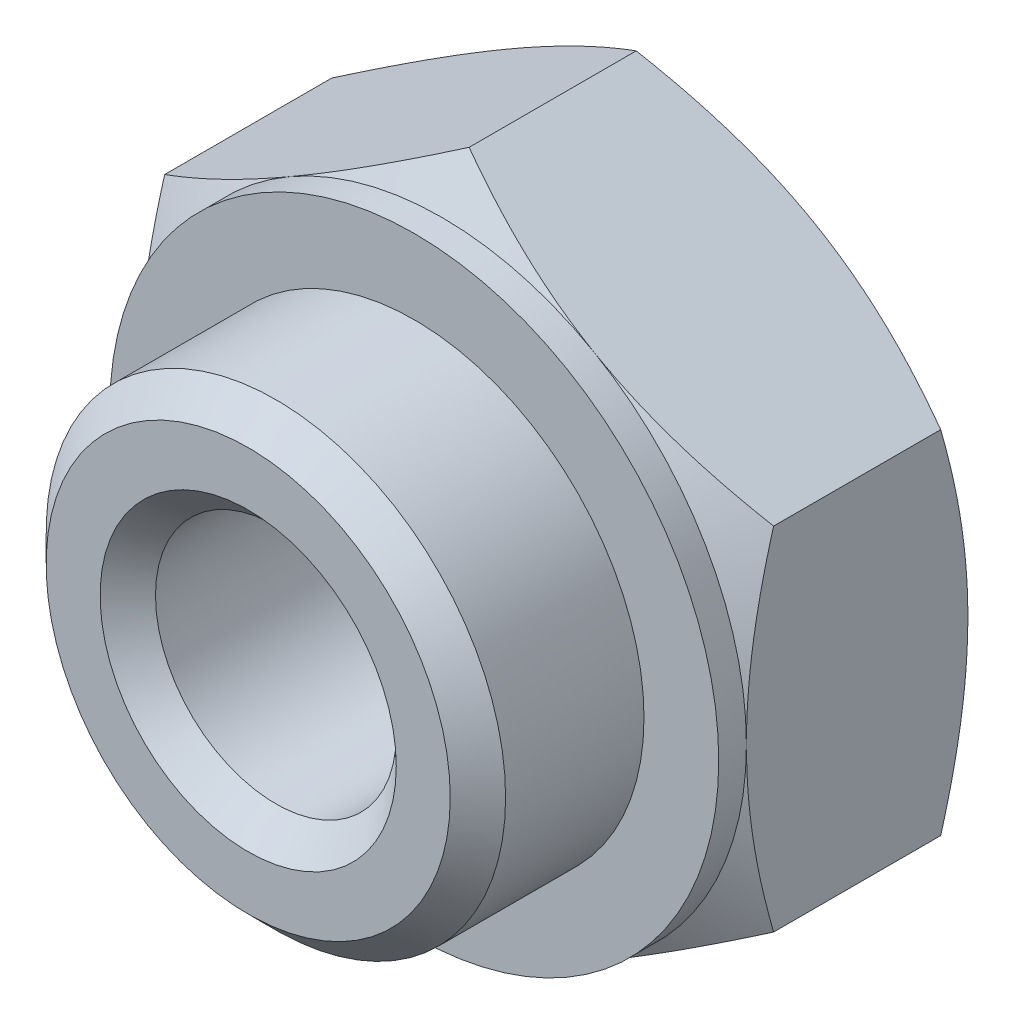
from build123d import *

# Parameters (mm, degrees)
SKETCH1_R                            = 4.35
BOSS_EXTRUDE1_DEPTH                  = 8
SKETCH2_R                            = 11
SKETCH2_R_2                          = 4.35
BOSS_EXTRUDE2_DEPTH                  = 1
SKETCH3_R                            = 8.3
SKETCH3_R_2                          = 4.35
BOSS_EXTRUDE3_DEPTH                  = 6
SZKIC9_OUTSIDE_W                     = 34.824
SZKIC9_OUTSIDE_H                     = 38.228
SZKIC9_OUTSIDE_R                     = 11
WYTNIJ_WYCI_GNI_CIE3_DEPTH           = 1
WYTNIJ_WYCI_GNI_CIE3_DRAFT           = -60
SZKIC10_OUTSIDE_W                    = 34.824
SZKIC10_OUTSIDE_H                    = 38.228
SZKIC10_OUTSIDE_R                    = 11
WYTNIJ_WYCI_GNI_CIE4_DEPTH           = 1
WYTNIJ_WYCI_GNI_CIE4_DRAFT           = -60
SZKIC11_R                            = 5.35
WYTNIJ_WYCI_GNI_CIE5_DEPTH           = 1
WYTNIJ_WYCI_GNI_CIE5_DRAFT           = -60
SZKIC13_OUTSIDE_W                    = 33.36
SZKIC13_OUTSIDE_H                    = 36.764
SZKIC13_OUTSIDE_R                    = 7.3
WYTNIJ_WYCI_GNI_CIE8_DEPTH           = 1
WYTNIJ_WYCI_GNI_CIE8_DRAFT           = -45
SZKIC13_OUTSIDE_R_2                  = 5.35
WYTNIJ_WYCI_GNI_CIE8_PROFILE_2_DEPTH = 1
WYTNIJ_WYCI_GNI_CIE8_PROFILE_2_DRAFT = -45


with BuildPart() as part:
    # Sketch1 → Boss-Extrude1 (new body)
    with BuildSketch(Plane.XY):
        Polygon((-11, 6.350852961), (-11, -6.350852961), (0, -12.701705922), (11, -6.350852961), (11, 6.350852961), (0, 12.701705922), align=None)
        Circle(SKETCH1_R, mode=Mode.SUBTRACT)
    extrude(amount=BOSS_EXTRUDE1_DEPTH)

    # Sketch2 → Boss-Extrude2 (add)
    with BuildSketch(Plane.XY.offset(8)):
        Circle(SKETCH2_R)
        Circle(SKETCH2_R_2, mode=Mode.SUBTRACT)
    extrude(amount=BOSS_EXTRUDE2_DEPTH)

    # Sketch3 → Boss-Extrude3 (add)
    with BuildSketch(Plane.XY.offset(9)):
        Circle(SKETCH3_R)
        Circle(SKETCH3_R_2, mode=Mode.SUBTRACT)
    extrude(amount=BOSS_EXTRUDE3_DEPTH)


with BuildPart() as wytnij_wyci_gni_cie3_tool:
    # Szkic9 outside → Wytnij-wyciągnięcie3 (with draft: the straight prism first)
    with BuildSketch(Plane(origin=(0, 0, 0), x_dir=(-1, 0, 0), z_dir=(0, 0, -1))):
        Rectangle(SZKIC9_OUTSIDE_W, SZKIC9_OUTSIDE_H)
        with Locations(Location((0, 0, 0), (0, 0, 180))):
            Circle(SZKIC9_OUTSIDE_R, mode=Mode.SUBTRACT)
    extrude(amount=-WYTNIJ_WYCI_GNI_CIE3_DEPTH)
    # Wytnij-wyciągnięcie3: the draft: its side faces are tilted about the plane it starts from
    wytnij_wyci_gni_cie3_sides = [wytnij_wyci_gni_cie3_tool.faces().sort_by_distance(p)[0] for p in [
        (0, -19.114, 0.5),
        (-17.412, 0, 0.5),
        (0, 19.114, 0.5),
        (17.412, 0, 0.5),
        (-11, 0, 0.5),
    ]]
    draft(wytnij_wyci_gni_cie3_sides, Plane(origin=(0, 0, 0), x_dir=(-1, 0, 0), z_dir=(0, 0, -1)), WYTNIJ_WYCI_GNI_CIE3_DRAFT)


with BuildPart() as part_1:
    add(part.part)

    # Wytnij-wyciągnięcie3: cut by wytnij_wyci_gni_cie3_tool
    add(wytnij_wyci_gni_cie3_tool.part, mode=Mode.SUBTRACT)


with BuildPart() as wytnij_wyci_gni_cie4_tool:
    # Szkic10 outside → Wytnij-wyciągnięcie4 (with draft: the straight prism first)
    with BuildSketch(Plane.XY.offset(8)):
        Rectangle(SZKIC10_OUTSIDE_W, SZKIC10_OUTSIDE_H)
        Circle(SZKIC10_OUTSIDE_R, mode=Mode.SUBTRACT)
    extrude(amount=-WYTNIJ_WYCI_GNI_CIE4_DEPTH)
    # Wytnij-wyciągnięcie4: the draft: its side faces are tilted about the plane it starts from
    wytnij_wyci_gni_cie4_sides = [wytnij_wyci_gni_cie4_tool.faces().sort_by_distance(p)[0] for p in [
        (0, -19.114, 7.5),
        (17.412, 0, 7.5),
        (0, 19.114, 7.5),
        (-17.412, 0, 7.5),
        (-11, 0, 7.5),
    ]]
    draft(wytnij_wyci_gni_cie4_sides, Plane.XY.offset(8), WYTNIJ_WYCI_GNI_CIE4_DRAFT)


with BuildPart() as part_2:
    add(part_1.part)

    # Wytnij-wyciągnięcie4: cut by wytnij_wyci_gni_cie4_tool
    add(wytnij_wyci_gni_cie4_tool.part, mode=Mode.SUBTRACT)


with BuildPart() as wytnij_wyci_gni_cie5_tool:
    # Szkic11 → Wytnij-wyciągnięcie5 (with draft: the straight prism first)
    with BuildSketch(Plane(origin=(0, 0, 0), x_dir=(-1, 0, 0), z_dir=(0, 0, -1))):
        Circle(SZKIC11_R)
    extrude(amount=-WYTNIJ_WYCI_GNI_CIE5_DEPTH)
    # Wytnij-wyciągnięcie5: the draft: its side faces are tilted about the plane it starts from
    wytnij_wyci_gni_cie5_sides = [wytnij_wyci_gni_cie5_tool.faces().sort_by_distance(p)[0] for p in [
        (5.35, 0, 0.5),
    ]]
    draft(wytnij_wyci_gni_cie5_sides, Plane(origin=(0, 0, 0), x_dir=(-1, 0, 0), z_dir=(0, 0, -1)), WYTNIJ_WYCI_GNI_CIE5_DRAFT)


with BuildPart() as part_3:
    add(part_2.part)

    # Wytnij-wyciągnięcie5: cut by wytnij_wyci_gni_cie5_tool
    add(wytnij_wyci_gni_cie5_tool.part, mode=Mode.SUBTRACT)


with BuildPart() as wytnij_wyci_gni_cie8_tool:
    # Szkic13 outside → Wytnij-wyciągnięcie8 (with draft: the straight prism first)
    with BuildSketch(Plane.XY.offset(15)):
        Rectangle(SZKIC13_OUTSIDE_W, SZKIC13_OUTSIDE_H)
        Circle(SZKIC13_OUTSIDE_R, mode=Mode.SUBTRACT)
    extrude(amount=-WYTNIJ_WYCI_GNI_CIE8_DEPTH)
    # Wytnij-wyciągnięcie8: the draft: its side faces are tilted about the plane it starts from
    wytnij_wyci_gni_cie8_sides = [wytnij_wyci_gni_cie8_tool.faces().sort_by_distance(p)[0] for p in [
        (0, -18.382, 14.5),
        (16.68, 0, 14.5),
        (0, 18.382, 14.5),
        (-16.68, 0, 14.5),
        (-7.3, 0, 14.5),
    ]]
    draft(wytnij_wyci_gni_cie8_sides, Plane.XY.offset(15), WYTNIJ_WYCI_GNI_CIE8_DRAFT)


with BuildPart() as part_4:
    add(part_3.part)

    # Wytnij-wyciągnięcie8: cut by wytnij_wyci_gni_cie8_tool
    add(wytnij_wyci_gni_cie8_tool.part, mode=Mode.SUBTRACT)


with BuildPart() as wytnij_wyci_gni_cie8_profile_2_tool:
    # Szkic13 outside → Wytnij-wyciągnięcie8 profile 2 (with draft: the straight prism first)
    with BuildSketch(Plane.XY.offset(15)):
        Circle(SZKIC13_OUTSIDE_R_2)
    extrude(amount=-WYTNIJ_WYCI_GNI_CIE8_PROFILE_2_DEPTH)
    # Wytnij-wyciągnięcie8 profile 2: the draft: its side faces are tilted about the plane it starts from
    wytnij_wyci_gni_cie8_profile_2_sides = [wytnij_wyci_gni_cie8_profile_2_tool.faces().sort_by_distance(p)[0] for p in [
        (-5.35, 0, 14.5),
    ]]
    draft(wytnij_wyci_gni_cie8_profile_2_sides, Plane.XY.offset(15), WYTNIJ_WYCI_GNI_CIE8_PROFILE_2_DRAFT)


with BuildPart() as part_5:
    add(part_4.part)

    # Wytnij-wyciągnięcie8 profile 2: cut by wytnij_wyci_gni_cie8_profile_2_tool
    add(wytnij_wyci_gni_cie8_profile_2_tool.part, mode=Mode.SUBTRACT)


solid = part_5.part
